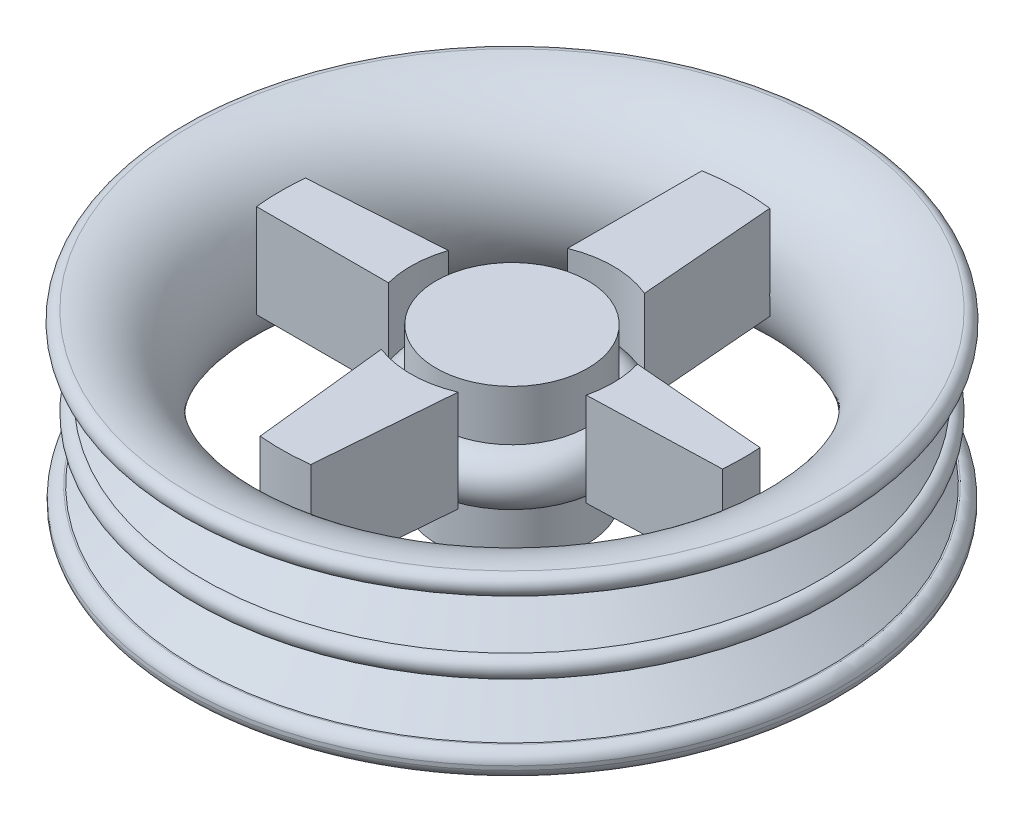
from build123d import *

# Parameters (mm, degrees)
BOSS_EXTRUDE1_DEPTH      = 37
BOSS_EXTRUDE2_DEPTH      = 3
BOSS_EXTRUDE2_DEPTH_BACK = 37
BOSS_EXTRUDE3_DEPTH      = 37
BOSS_EXTRUDE4_DEPTH      = 37


with BuildPart() as part:
    # Sketch1 → Revolve4 (revolve)
    with BuildSketch(Plane.XY, mode=Mode.PRIVATE) as revolve4_sk:
        with BuildLine():
            Line((30, 20), (30, 0))
            Line((30, 0), (0, 0))
            Line((0, 0), (0, 60))
            Line((0, 60), (30, 60))
            Line((30, 60), (30, 40))
            ThreePointArc((30, 40), (40, 30), (30, 20))
        make_face()
        with BuildLine():
            Line((125.39437567, 4.917905926), (124.834554496, 4.917905926))
            Line((124.834554496, 4.917905926), (109.175592252, 17.277045335))
            Line((109.175592252, 17.277045335), (122.458911333, 26))
            ThreePointArc((122.458911333, 26), (126.458911333, 30), (122.458911333, 34))
            Line((122.458911333, 34), (109.175592252, 46.215008847))
            Line((109.175592252, 46.215008847), (126.458911333, 57.226838088))
            ThreePointArc((126.458911333, 57.226838088), (130.345492289, 61.113419044), (126.458911333, 65))
            ThreePointArc((126.458911333, 65), (91.46767299, 30.783095946), (124.89311151, -4.964957756))
            ThreePointArc((124.89311151, -4.964957756), (128.23936955, -3.858236482), (130, -0.804966878))
            Line((130, -0.804966878), (130, 0.760885091))
            ThreePointArc((130, 0.760885091), (128.429681874, 3.650936393), (125.39437567, 4.917905926))
        make_face()
    revolve(revolve4_sk.sketch.rotate(Axis((0, 0, 0), (0, 1, 0)), 90), axis=Axis((0, 0, 0), (0, 1, 0)))


with BuildPart() as body_2:
    # Sketch2 → Boss-Extrude1 (new body)
    with BuildSketch(Plane(origin=(0, 60, 0), x_dir=(1, 0, 0), z_dir=(0, 1, 0))):
        with BuildLine():
            Line((-15.079077499, 90.207282876), (-15.079077499, 37.048905811))
            ThreePointArc((-15.079077499, 37.048905811), (0.242840423, 39.99926285), (15.527806264, 36.863087671))
            Line((15.527806264, 36.863087671), (11.197455462, 90.770862359))
            ThreePointArc((11.197455462, 90.770862359), (-1.961161102, 91.437882244), (-15.079077499, 90.207282876))
        make_face()
    extrude(amount=-BOSS_EXTRUDE1_DEPTH)


with BuildPart() as body_3:
    # Sketch3 → Boss-Extrude2 (new, two sides: drawn at the far end of the back side and taken through both)
    with BuildSketch(Plane(origin=(0, 60, 0), x_dir=(1, 0, 0), z_dir=(0, 1, 0)).offset(-BOSS_EXTRUDE2_DEPTH_BACK)):
        with BuildLine():
            Line((-14.341098737, -37.340767092), (-8.544849509, -91.058871117))
            ThreePointArc((-8.544849509, -91.058871117), (1.329438663, -91.449248521), (11.18820632, -90.772002851))
            Line((11.18820632, -90.772002851), (15.527806264, -36.863087671))
            ThreePointArc((15.527806264, -36.863087671), (0.639619493, -39.994885759), (-14.341098737, -37.340767092))
        make_face()
    extrude(amount=BOSS_EXTRUDE2_DEPTH + BOSS_EXTRUDE2_DEPTH_BACK)


with BuildPart() as body_4:
    # Sketch4 → Boss-Extrude3 (new body)
    with BuildSketch(Plane(origin=(0, 60, 0), x_dir=(1, 0, 0), z_dir=(0, 1, 0))):
        with BuildLine():
            Line((38.850856375, -9.518978882), (91.118189277, -7.887207687))
            ThreePointArc((91.118189277, -7.887207687), (91.457498542, -0.508352864), (91.200236236, 6.873817912))
            Line((91.200236236, 6.873817912), (38.393139081, 11.223496403))
            ThreePointArc((38.393139081, 11.223496403), (39.990264799, 0.882451854), (38.850856375, -9.518978882))
        make_face()
    extrude(amount=-BOSS_EXTRUDE3_DEPTH)


with BuildPart() as body_5:
    # Sketch5 → Boss-Extrude4 (new body)
    with BuildSketch(Plane(origin=(0, 60, 0), x_dir=(1, 0, 0), z_dir=(0, 1, 0))):
        with BuildLine():
            Line((-90.983173728, 9.316359837), (-37.907866165, 12.766897931))
            ThreePointArc((-37.907866165, 12.766897931), (-39.976564179, 1.369056784), (-38.692470372, -10.143605695))
            Line((-38.692470372, -10.143605695), (-90.894662801, -10.143605695))
            ThreePointArc((-90.894662801, -10.143605695), (-91.457965316, -0.415983742), (-90.983173728, 9.316359837))
        make_face()
    extrude(amount=-BOSS_EXTRUDE4_DEPTH)


solid = Compound([part.part, body_2.part, body_3.part, body_4.part, body_5.part])
